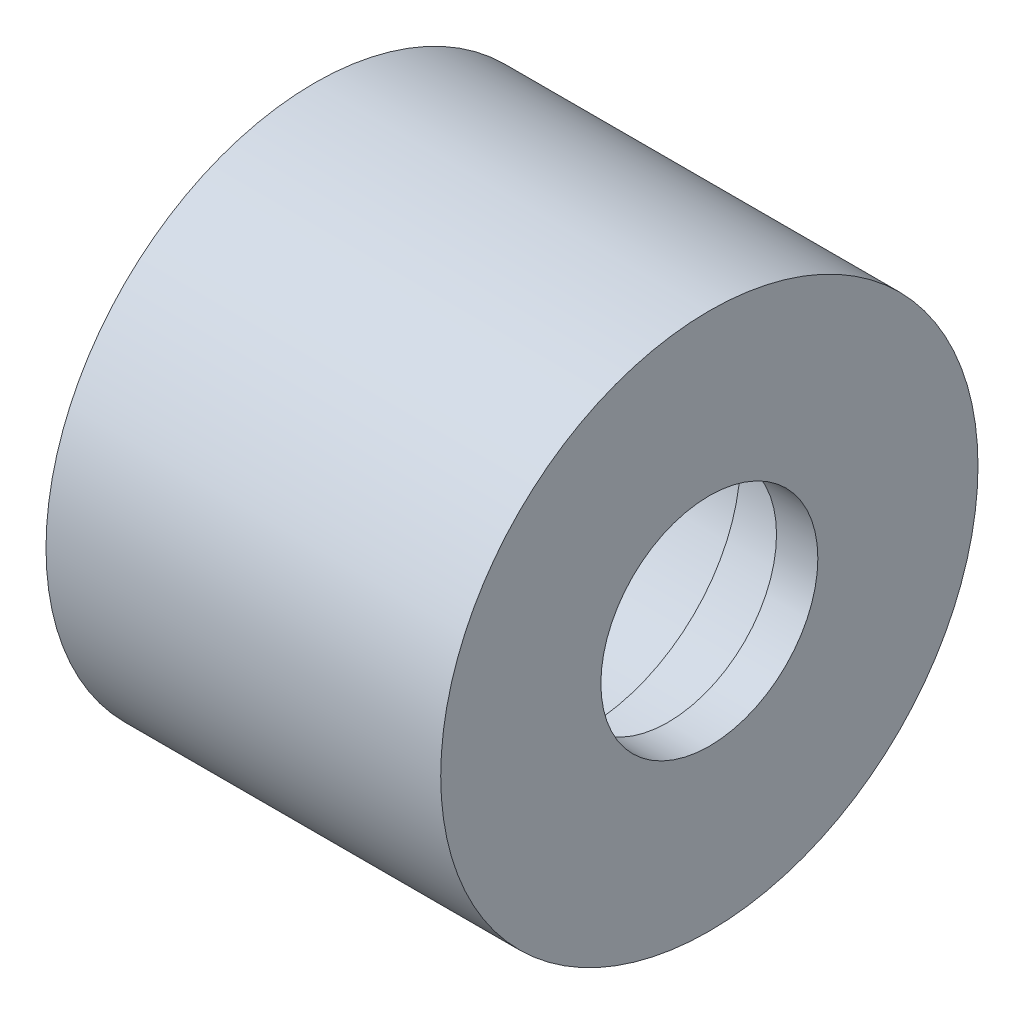
from build123d import *

# Parameters (mm, degrees)
CIRPATTERN1_COUNT = 6


with BuildPart() as part:
    # Sketch1 → Revolve1 (revolve)
    with BuildSketch(Plane.XY):
        Polygon((0, 26), (0, 21), (15.5, 21), (15.5, 20), (19.2, 20), (19.2, 16), (26.2, 16), (26.2, 15), (34.2, 15), (34.2, 10.5), (38.2, 10.5), (38.2, 26), align=None)
    revolve(axis=Axis((-4.437766072, 0, 0), (1, 0, 0)))

    # Sketch3 → M3 Tapped Hole1 (revolve, cut)
    with BuildSketch(Plane(origin=(0, 20.351596989, 11.75), x_dir=(0, 0, 1), z_dir=(0, 1, 0))):
        Polygon((0, 0), (0, 8.251075774), (1.25, 7.5), (1.25, 0), align=None)
    m3_tapped_hole1 = revolve(axis=Axis((-6.35, 20.351596989, 11.75), (1, 0, 0)), mode=Mode.SUBTRACT)

    # CirPattern1: M3 Tapped Hole1 ×6 about axis
    cirpattern1_axis = Axis((-4.437766072, 0, 0), (1, 0, 0))
    for i in range(1, CIRPATTERN1_COUNT):
        add(m3_tapped_hole1.rotate(cirpattern1_axis, i * 360 / CIRPATTERN1_COUNT), mode=Mode.SUBTRACT)


solid = part.part
